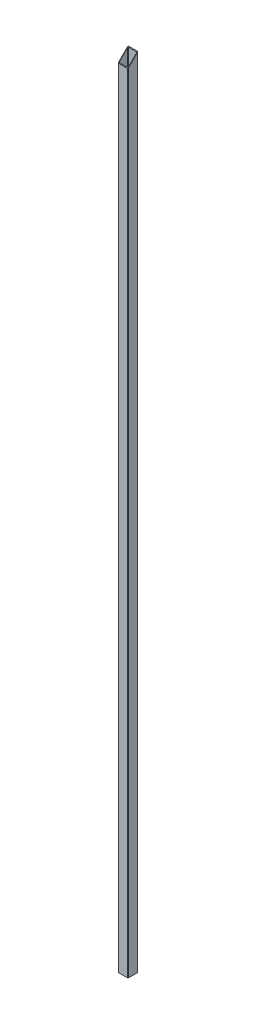
from build123d import *

# Parameters (mm, degrees)
EXTRUDE_1_DEPTH     = 3200
CUT_EXTRUDE_1_DEPTH = 3201.312484743


with BuildPart() as part:
    # Эскиз2 → Бобышка-Вытянуть1 (new body)
    with BuildSketch(Plane(origin=(0, 0, 0), x_dir=(1, 0, 0), z_dir=(0, 1, 0))):
        with BuildLine():
            Line((-18, 20), (18, 20))
            ThreePointArc((18, 20), (19.414213562, 19.414213562), (20, 18))
            Line((20, 18), (20, -18))
            ThreePointArc((20, -18), (19.414213562, -19.414213562), (18, -20))
            Line((18, -20), (-18, -20))
            ThreePointArc((-18, -20), (-19.414213562, -19.414213562), (-20, -18))
            Line((-20, -18), (-20, 18))
            ThreePointArc((-20, 18), (-19.414213562, 19.414213562), (-18, 20))
        make_face()
        with BuildLine():
            Line((16, -18), (-16, -18))
            ThreePointArc((-16, -18), (-17.414213562, -17.414213562), (-18, -16))
            Line((-18, -16), (-18, 16))
            ThreePointArc((-18, 16), (-17.414213562, 17.414213562), (-16, 18))
            Line((-16, 18), (16, 18))
            ThreePointArc((16, 18), (17.414213562, 17.414213562), (18, 16))
            Line((18, 16), (18, -16))
            ThreePointArc((18, -16), (17.414213562, -17.414213562), (16, -18))
        make_face(mode=Mode.SUBTRACT)
    extrude(amount=EXTRUDE_1_DEPTH)

    # Эскиз3 → Вырез-Вытянуть1 (cut, through all)
    with BuildSketch(Plane(origin=(20, 0, 0), x_dir=(0, 0, -1), z_dir=(1, 0, 0))):
        Polygon((20, 3200), (-20, 3200), (-20, 3160), align=None)
    extrude(amount=-CUT_EXTRUDE_1_DEPTH, mode=Mode.SUBTRACT)


solid = part.part
